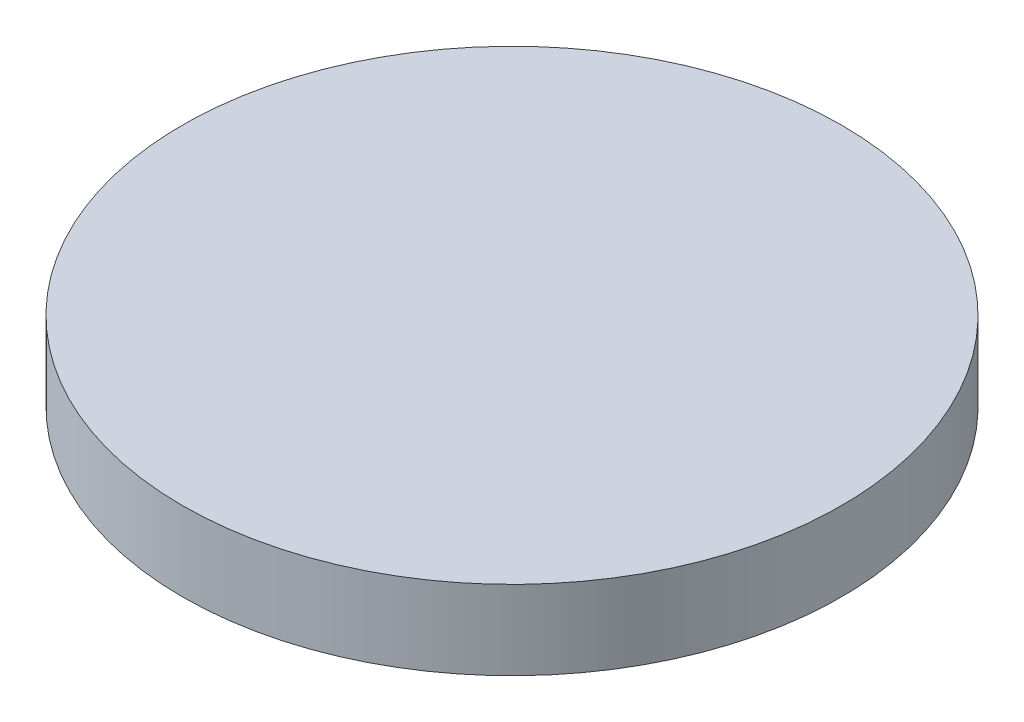
from build123d import *

# Parameters (mm, degrees)
ESQUISSE1_R        = 150
BOSS_EXTRU_1_DEPTH = 36


with BuildPart() as part:
    # Esquisse1 → Boss.-Extru.1 (new body)
    with BuildSketch(Plane(origin=(0, 0, 0), x_dir=(1, 0, 0), z_dir=(0, 1, 0))):
        with Locations(Location((31.476067469, 27.741618786, 0), (0, 0, 270))):
            Circle(ESQUISSE1_R)
    extrude(amount=BOSS_EXTRU_1_DEPTH)


solid = part.part
